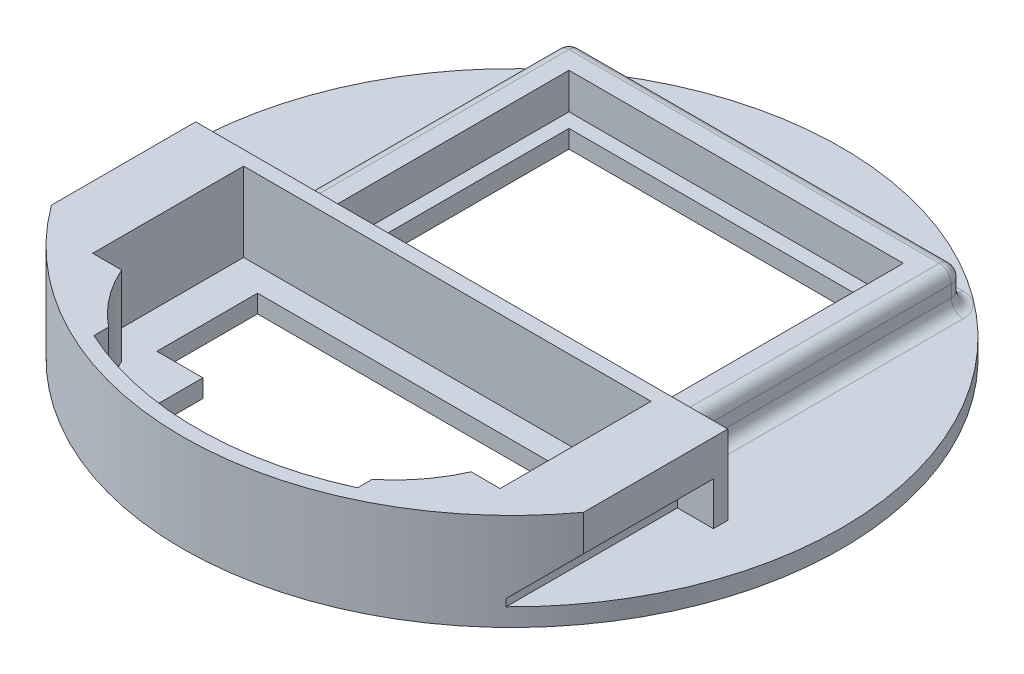
from build123d import *

# Parameters (mm, degrees)
SKETCH1_R           = 27.5
SKETCH1_W           = 25.5
SKETCH1_H           = 17
BOSS_EXTRUDE1_DEPTH = 1.5
BOSS_EXTRUDE2_START = 6.6
BOSS_EXTRUDE2_DEPTH = 6.6
CUT_EXTRUDE1_REACH  = 45.381
SKETCH1_5_W         = 32.9
SKETCH1_5_H         = 25.4
SKETCH1_5_W_2       = 27.9
SKETCH1_5_H_2       = 19.4
BOSS_EXTRUDE3_DEPTH = 3
FILLET1_R           = 1


with BuildPart() as part:
    # Sketch1 → Boss-Extrude1 (new body)
    with BuildSketch(Plane(origin=(0, 0, 0), x_dir=(1, 0, 0), z_dir=(0, 1, 0))):
        with Locations((0, 11.695639977)):
            Circle(SKETCH1_R)
        with BuildLine():
            Line((10, -4.1), (10, -12.629038849))
            ThreePointArc((10, -12.629038849), (0, -14.604360023), (-10, -12.629038849))
            Line((-10, -12.629038849), (-10, -4.1))
            Line((-10, -4.1), (-13.837653888, -4.1))
            Line((-13.837653888, -4.1), (-13.837653888, 4.3))
            Line((-13.837653888, 4.3), (13.837653888, 4.3))
            Line((13.837653888, 4.3), (13.837653888, -4.1))
            Line((13.837653888, -4.1), (10, -4.1))
        make_face(mode=Mode.SUBTRACT)
        with Locations((0, 20.7)):
            Rectangle(SKETCH1_W, SKETCH1_H, mode=Mode.SUBTRACT)
    extrude(amount=-BOSS_EXTRUDE1_DEPTH)

    # Sketch1<3> → Boss-Extrude2 (add)
    with BuildSketch(Plane(origin=(0, 0, 0), x_dir=(1, 0, 0), z_dir=(0, 1, 0)).offset(BOSS_EXTRUDE2_START)):
        with BuildLine():
            Line((-16.45, 7.5), (-22.2, 7.5))
            Line((-22.2, 7.5), (-22.2, -4.534270682))
            ThreePointArc((-22.2, -4.534270682), (0, -15.804360023), (22.2, -4.534270682))
            Line((22.2, -4.534270682), (22.2, 7.5))
            Line((22.2, 7.5), (16.45, 7.5))
            Line((16.45, 7.5), (-16.45, 7.5))
        make_face()
        with BuildLine():
            Line((-17, -6.3), (-17, 6.3))
            Line((-17, 6.3), (17, 6.3))
            Line((17, 6.3), (17, -6.3))
            Line((17, -6.3), (14.582906959, -6.3))
            ThreePointArc((14.582906959, -6.3), (13.072174848, -8.850843183), (11, -10.971032764))
            Line((11, -10.971032764), (11, -12.193478885))
            ThreePointArc((11, -12.193478885), (10.502258239, -12.416443547), (10, -12.629038849))
            ThreePointArc((10, -12.629038849), (0, -14.604360023), (-10, -12.629038849))
            ThreePointArc((-10, -12.629038849), (-10.502258239, -12.416443547), (-11, -12.193478885))
            Line((-11, -12.193478885), (-11, -10.971032764))
            ThreePointArc((-11, -10.971032764), (-13.072174848, -8.850843183), (-14.582906959, -6.3))
            Line((-14.582906959, -6.3), (-17, -6.3))
        make_face(mode=Mode.SUBTRACT)
    extrude(amount=-BOSS_EXTRUDE2_DEPTH)

    # Sketch2 → Cut-Extrude1 (cut, up to next)
    with BuildSketch(Plane.XY.offset(-6.3), mode=Mode.PRIVATE) as cut_extrude1_sk1:
        Polygon((-22.2, 3.6), (-19.2, 0.6), (-19.2, 0), (-22.2, 0), align=None)
    cut_extrude1_tool1 = extrude(cut_extrude1_sk1.sketch, amount=CUT_EXTRUDE1_REACH, mode=Mode.PRIVATE) & part.part
    # Sketch2 → Cut-Extrude1 (cut, up to next)
    with BuildSketch(Plane.XY.offset(-6.3), mode=Mode.PRIVATE) as cut_extrude1_sk2:
        Polygon((19.2, 0.6), (19.2, 0), (22.2, 0), (22.2, 3.6), align=None)
    cut_extrude1_tool2 = extrude(cut_extrude1_sk2.sketch, amount=CUT_EXTRUDE1_REACH, mode=Mode.PRIVATE) & part.part
    add(cut_extrude1_tool1.solids().sort_by_distance((-21.057143, 1.228571, -6.3))[0], mode=Mode.SUBTRACT)
    add(cut_extrude1_tool2.solids().sort_by_distance((21.057143, 1.228571, -6.3))[0], mode=Mode.SUBTRACT)

    # Sketch1<5> → Boss-Extrude3 (add)
    with BuildSketch(Plane(origin=(0, 0, 0), x_dir=(1, 0, 0), z_dir=(0, 1, 0))):
        with Locations((0, 20.2)):
            Rectangle(SKETCH1_5_W, SKETCH1_5_H)
        with Locations((0, 20.7)):
            Rectangle(SKETCH1_5_W_2, SKETCH1_5_H_2, mode=Mode.SUBTRACT)
    extrude(amount=BOSS_EXTRUDE3_DEPTH)

    # Fillet1
    fillet1_edges = [part.edges().sort_by_distance(p)[0] for p in [
        (-16.45, 3, -20.2),
        (-16.45, 0, -20.2),
        (16.45, 3, -20.2),
        (16.45, 0, -20.2),
        (16.45, 1.5, -32.9),
        (0, 3, -32.9),
        (-16.45, 1.5, -32.9),
        (0, 0, -32.9),
        (0, 3, -7.5),
        (-16.45, 1.5, -7.5),
        (16.45, 1.5, -7.5),
    ]]
    fillet(fillet1_edges, radius=FILLET1_R)


solid = part.part
